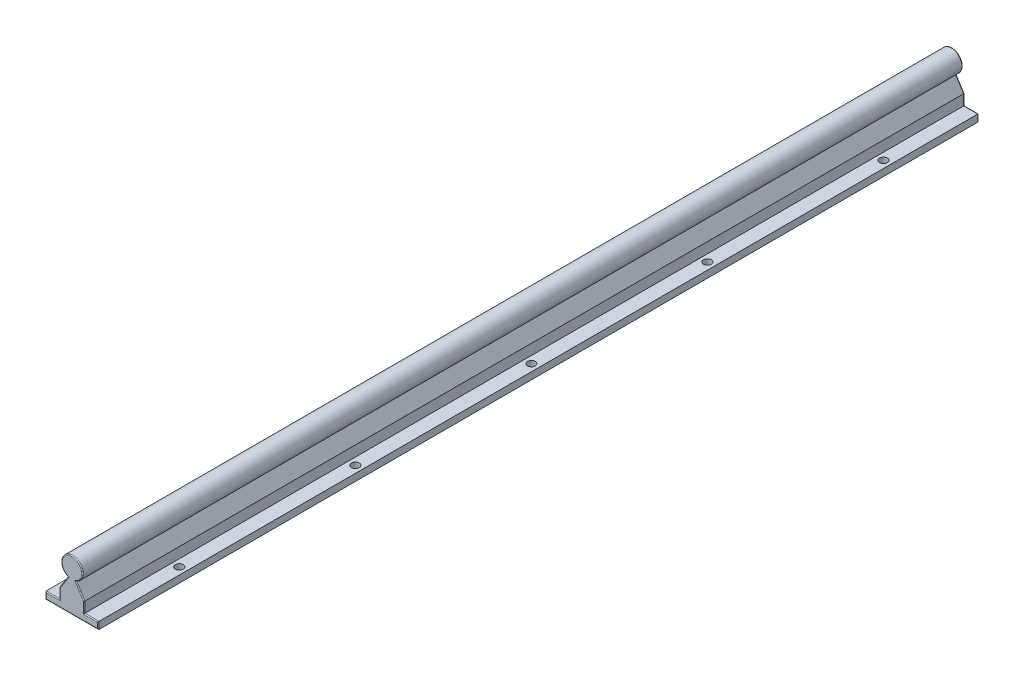
from build123d import *

# Parameters (mm, degrees)
BOSS_EXTRUDE1_DEPTH  = 500
SKETCH2_R            = 2.25
CUT_EXTRUDE1_DEPTH   = 502.06486606
LPATTERN1_COUNT      = 5
LPATTERN1_PITCH      = 100
LPATTERN1_COUNT_DIR2 = 2
LPATTERN1_PITCH_DIR2 = 22
FILLET1_R            = 0.5


with BuildPart() as part:
    # Sketch1 → Boss-Extrude1 (new body)
    with BuildSketch(Plane.XY):
        with BuildLine():
            Line((-15, 0), (15, 0))
            Line((15, 0), (15, 4))
            Line((15, 4), (7, 4))
            Line((7, 4), (7, 10))
            Line((7, 10), (2.259191805, 17.441578247))
            ThreePointArc((2.259191805, 17.441578247), (0, 29), (-2.259191805, 17.441578247))
            Line((-2.259191805, 17.441578247), (-7, 10))
            Line((-7, 10), (-7, 4))
            Line((-7, 4), (-15, 4))
            Line((-15, 4), (-15, 0))
        make_face()
    extrude(amount=BOSS_EXTRUDE1_DEPTH)

    # Sketch2 → Cut-Extrude1 (cut, through all)
    with BuildSketch(Plane.XZ):
        with Locations((-11, 50)):
            Circle(SKETCH2_R)
    cut_extrude1 = extrude(amount=-CUT_EXTRUDE1_DEPTH, mode=Mode.SUBTRACT)

    # LPattern1: Cut-Extrude1 5 × 2
    with Locations(*[(j * LPATTERN1_PITCH_DIR2, 0, i * LPATTERN1_PITCH) for i in range(LPATTERN1_COUNT) for j in range(LPATTERN1_COUNT_DIR2) if (i, j) != (0, 0)]):
        add(cut_extrude1, mode=Mode.SUBTRACT)

    # Fillet1
    fillet1_edges = [part.edges().sort_by_distance(p)[0] for p in [
        (-11, 4, 0),
        (-15, 2, 0),
        (0, 0, 0),
        (15, 2, 0),
        (11, 4, 0),
        (7, 7, 0),
        (4.629595903, 13.720789123, 0),
        (0, 29, 500),
        (0, 29, 0),
        (-4.629595903, 13.720789123, 0),
        (-7, 7, 0),
        (4.629595903, 13.720789123, 500),
        (7, 7, 500),
        (11, 4, 500),
        (15, 2, 500),
        (0, 0, 500),
        (-15, 2, 500),
        (-11, 4, 500),
        (-7, 7, 500),
        (-4.629595903, 13.720789123, 500),
    ]]
    fillet(fillet1_edges, radius=FILLET1_R)


solid = part.part
